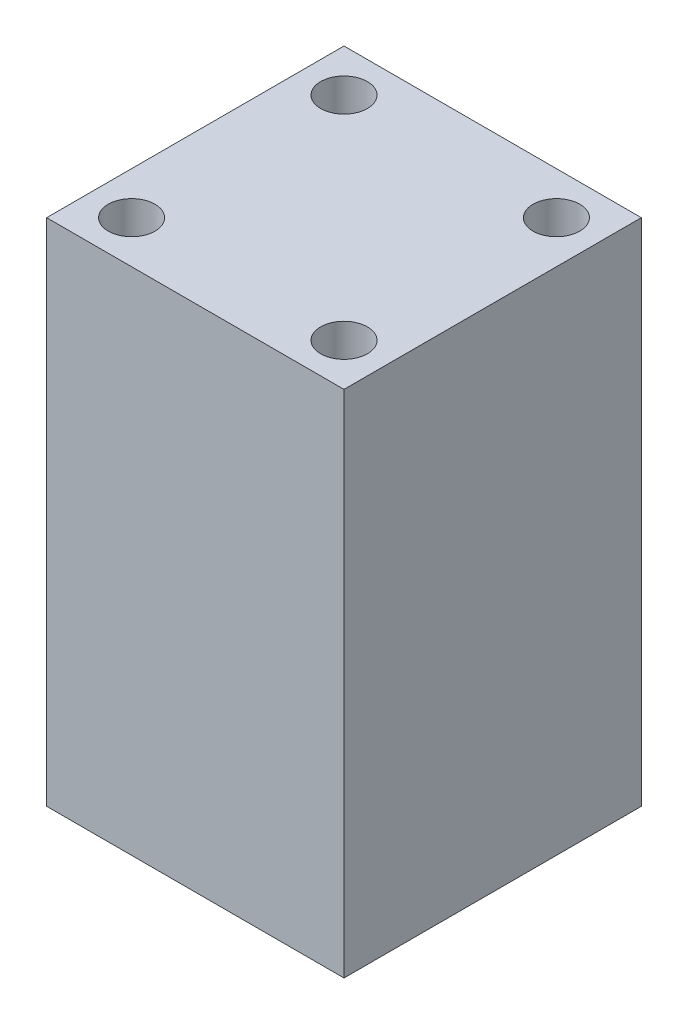
from build123d import *

# Parameters (mm, degrees)
SKETCH1_W           = 35
SKETCH1_H           = 35
BOSS_EXTRUDE1_DEPTH = 30


with BuildPart() as part:
    # Sketch1 → Boss-Extrude1 (new, symmetric)
    with BuildSketch(Plane(origin=(0, 0, 0), x_dir=(1, 0, 0), z_dir=(0, 1, 0))):
        Rectangle(SKETCH1_W, SKETCH1_H)
    extrude(amount=BOSS_EXTRUDE1_DEPTH, both=True)

    # Sketch3 → M5 Clearance Hole1 (revolve, cut)
    with BuildSketch(Plane(origin=(-12.5, 30, -12.5), x_dir=(0, 0, 1), z_dir=(1, 0, 0))):
        Polygon((0, 0), (0, 9.652366702), (2.75, 8), (2.75, 0), align=None)
    m5_clearance_hole1 = revolve(axis=Axis((-12.5, 36.35, -12.5), (0, -1, 0)), mode=Mode.SUBTRACT)

    # Mirror1: M5 Clearance Hole1 across plane
    add(m5_clearance_hole1.mirror(Plane(origin=(0, 0, 0), x_dir=(0, 0, 1), z_dir=(1, 0, 0))), mode=Mode.SUBTRACT)

    # Mirror2: M5 Clearance Hole1 across plane
    add(m5_clearance_hole1.mirror(Plane.XY), mode=Mode.SUBTRACT)

    # Mirror2 copy 1 sketch → Mirror2 copy 1 (revolve, cut)
    with BuildSketch(Plane(origin=(12.5, 30, 12.5), x_dir=(0, 0, -1), z_dir=(-1, 0, 0))):
        Polygon((0, 0), (0, 9.652366702), (2.75, 8), (2.75, 0), align=None)
    revolve(axis=Axis((12.5, 36.35, 12.5), (0, -1, 0)), mode=Mode.SUBTRACT)

    # Mirror3: M5 Clearance Hole1 across plane
    add(m5_clearance_hole1.mirror(Plane.ZX), mode=Mode.SUBTRACT)

    # Mirror3 copy 1 sketch → Mirror3 copy 1 (revolve, cut)
    with BuildSketch(Plane(origin=(12.5, -30, -12.5), x_dir=(0, 0, 1), z_dir=(-1, 0, 0))):
        Polygon((0, 0), (0, 9.652366702), (2.75, 8), (2.75, 0), align=None)
    revolve(axis=Axis((12.5, -36.35, -12.5), (0, 1, 0)), mode=Mode.SUBTRACT)

    # Mirror3 copy 2 sketch → Mirror3 copy 2 (revolve, cut)
    with BuildSketch(Plane(origin=(-12.5, -30, 12.5), x_dir=(0, 0, -1), z_dir=(1, 0, 0))):
        Polygon((0, 0), (0, 9.652366702), (2.75, 8), (2.75, 0), align=None)
    revolve(axis=Axis((-12.5, -36.35, 12.5), (0, 1, 0)), mode=Mode.SUBTRACT)

    # Mirror3 copy 3 sketch → Mirror3 copy 3 (revolve, cut)
    with BuildSketch(Plane(origin=(12.5, -30, 12.5), x_dir=(0, 0, -1), z_dir=(-1, 0, 0))):
        Polygon((0, 0), (0, -9.652366702), (2.75, -8), (2.75, 0), align=None)
    revolve(axis=Axis((12.5, -36.35, 12.5), (0, -1, 0)), mode=Mode.SUBTRACT)

    # Sketch8 → M4 Clearance Hole2 (revolve, cut)
    with BuildSketch(Plane(origin=(-17.5, 15, -12.5), x_dir=(0, 0, 1), z_dir=(0, 1, 0))):
        Polygon((0, 0), (0, 9.351936393), (2.25, 8), (2.25, 0), align=None)
    m4_clearance_hole2 = revolve(axis=Axis((-23.85, 15, -12.5), (1, 0, 0)), mode=Mode.SUBTRACT)

    # Mirror4: M4 Clearance Hole2 across plane
    add(m4_clearance_hole2.mirror(Plane.XY), mode=Mode.SUBTRACT)

    # Mirror5: M4 Clearance Hole2 across plane
    add(m4_clearance_hole2.mirror(Plane.ZX), mode=Mode.SUBTRACT)

    # Mirror5 copy 1 sketch → Mirror5 copy 1 (revolve, cut)
    with BuildSketch(Plane(origin=(-17.5, -15, 12.5), x_dir=(0, 0, -1), z_dir=(0, -1, 0))):
        Polygon((0, 0), (0, 9.351936393), (2.25, 8), (2.25, 0), align=None)
    revolve(axis=Axis((-23.85, -15, 12.5), (1, 0, 0)), mode=Mode.SUBTRACT)


solid = part.part
